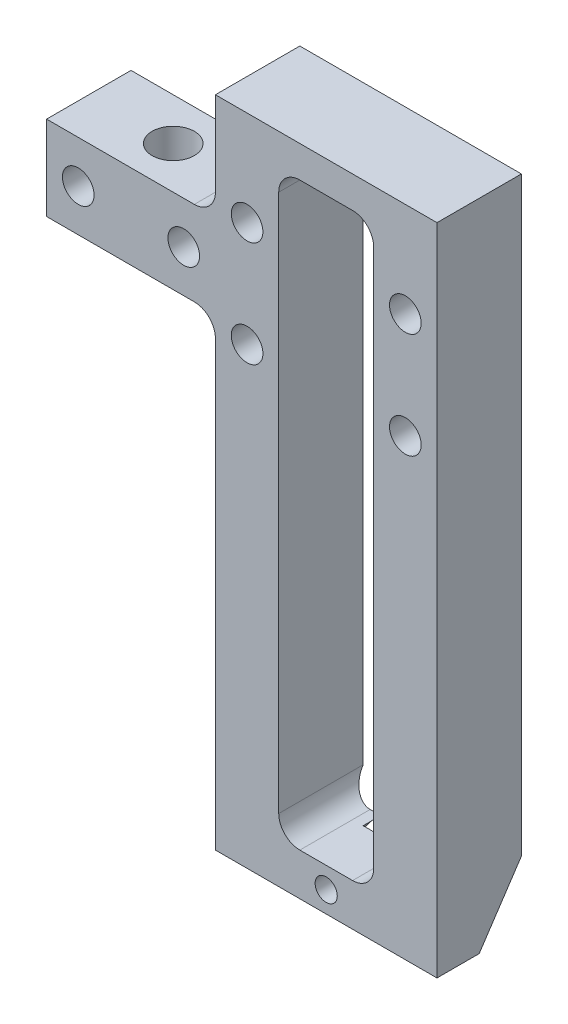
from build123d import *

# Parameters (mm, degrees)
SKETCH_1_R          = 1.5
EXTRUDE_1_DEPTH     = 8
FILLET_1_R          = 2
SKETCH_2_W          = 9
SKETCH_2_H          = 55
CUT_EXTRUDE_1_DEPTH = 73.642962495
FILLET_2_R          = 2
SKETCH_3_R          = 2
CUT_EXTRUDE_2_DEPTH = 59.043087444
SKETCH_4_R          = 1.05
CUT_EXTRUDE_3_DEPTH = 73.642962495
SKETCH_5_R          = 2.5
CUT_EXTRUDE_4_DEPTH = 3
CUT_EXTRUDE_5_DEPTH = 22


with BuildPart() as part:
    # 草图1 → 凸台-拉伸1 (new body)
    with BuildSketch(Plane.XY):
        Polygon((37, 62), (37, 0), (16, 0), (16, 44), (0, 44), (0, 52), (16, 52), (16, 62), align=None)
        with Locations((19, 53)):
            Circle(SKETCH_1_R, mode=Mode.SUBTRACT)
        with Locations((34, 53)):
            Circle(SKETCH_1_R, mode=Mode.SUBTRACT)
        with Locations((19, 43)):
            Circle(SKETCH_1_R, mode=Mode.SUBTRACT)
        with Locations((34, 43)):
            Circle(SKETCH_1_R, mode=Mode.SUBTRACT)
        with Locations((3, 48)):
            Circle(SKETCH_1_R, mode=Mode.SUBTRACT)
        with Locations((13, 48)):
            Circle(SKETCH_1_R, mode=Mode.SUBTRACT)
    extrude(amount=EXTRUDE_1_DEPTH)

    # 圆角1
    fillet_1_edges = [part.edges().sort_by_distance(p)[0] for p in [
        (16, 52, 4),
        (16, 44, 4),
    ]]
    fillet(fillet_1_edges, radius=FILLET_1_R)

    # 草图2 → 切除-拉伸1 (cut, through all)
    with BuildSketch(Plane.XY.offset(8)):
        with Locations((26.5, 31.5)):
            Rectangle(SKETCH_2_W, SKETCH_2_H)
    extrude(amount=-CUT_EXTRUDE_1_DEPTH, mode=Mode.SUBTRACT)

    # 圆角2
    fillet_2_edges = [part.edges().sort_by_distance(p)[0] for p in [
        (31, 59, 4),
        (31, 4, 4),
        (22, 4, 4),
        (22, 59, 4),
    ]]
    fillet(fillet_2_edges, radius=FILLET_2_R)

    # 草图3 → 切除-拉伸2 (cut, through all)
    with BuildSketch(Plane.XZ.offset(-44)):
        with Locations(Location((8, 4, 0), (0, 0, 270))):
            Circle(SKETCH_3_R)
    extrude(amount=-CUT_EXTRUDE_2_DEPTH, mode=Mode.SUBTRACT)

    # 草图4 → 切除-拉伸3 (cut, through all)
    with BuildSketch(Plane.XY.offset(8)):
        with Locations((26.5, 2)):
            Circle(SKETCH_4_R)
    extrude(amount=-CUT_EXTRUDE_3_DEPTH, mode=Mode.SUBTRACT)

    # 草图5 → 切除-拉伸4 (cut)
    with BuildSketch(Plane(origin=(0, 0, 0), x_dir=(-1, 0, 0), z_dir=(0, 0, -1))):
        with Locations((-26.5, 2)):
            Circle(SKETCH_5_R)
    extrude(amount=-CUT_EXTRUDE_4_DEPTH, mode=Mode.SUBTRACT)

    # 草图6 → 切除-拉伸5 (cut)
    with BuildSketch(Plane(origin=(37, 0, 0), x_dir=(0, 0, -1), z_dir=(1, 0, 0))):
        Polygon((-4, 0), (0, 6), (0, 0), align=None)
    extrude(amount=-CUT_EXTRUDE_5_DEPTH, mode=Mode.SUBTRACT)


solid = part.part
